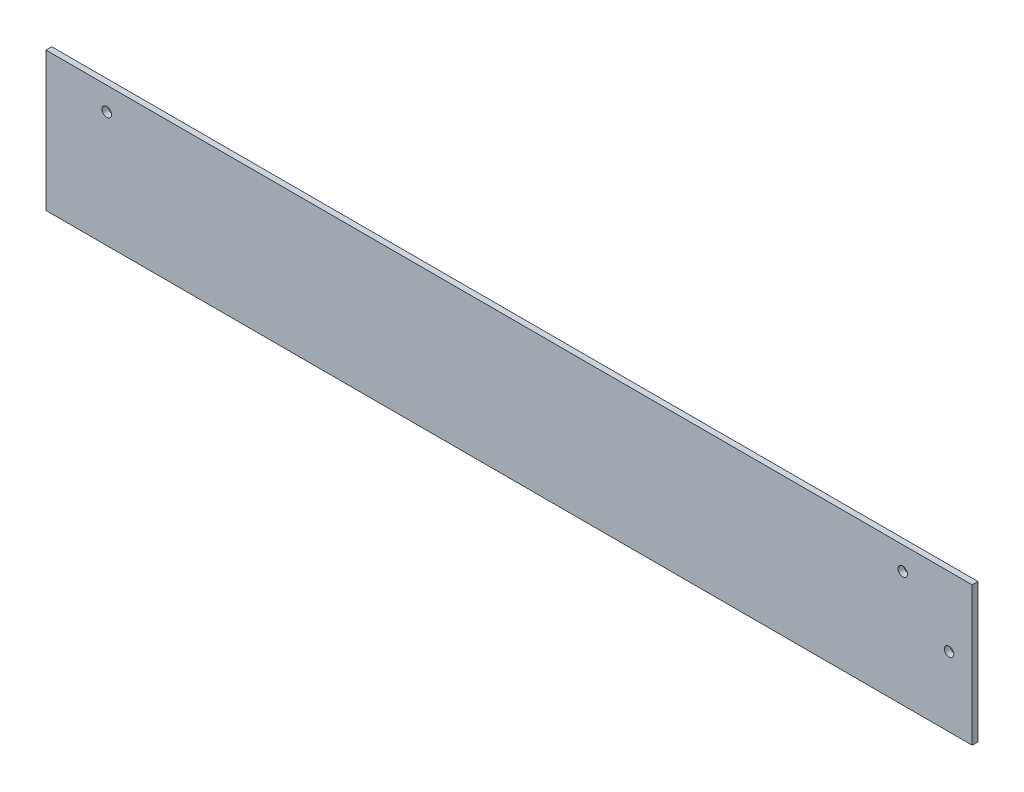
from build123d import *

# Parameters (mm, degrees)
SKETCH1_W           = 508
SKETCH1_H           = 508
BOSS_EXTRUDE1_DEPTH = 3.175
SKETCH2_R           = 2.54
SKETCH2_W           = 234.95
SKETCH2_H           = 368.3
CUT_EXTRUDE1_DEPTH  = 44.45
SKETCH4_R           = 2.159
CUT_EXTRUDE3_DEPTH  = 719.427505476
SKETCH5_R           = 2.6
CUT_EXTRUDE4_DEPTH  = 719.427505476
SKETCH6_W           = 20.6375
SKETCH6_H           = 119.54625
BOSS_EXTRUDE3_DEPTH = 3.175
SKETCH7_W           = 508
SKETCH7_H           = 431.8
CUT_EXTRUDE5_DEPTH  = 719.427505476


with BuildPart() as part:
    # Sketch1 → Boss-Extrude1 (new body)
    with BuildSketch(Plane.XY):
        with Locations((254, 254)):
            Rectangle(SKETCH1_W, SKETCH1_H)
    extrude(amount=BOSS_EXTRUDE1_DEPTH)

    # Sketch2 → Cut-Extrude1 (cut)
    with BuildSketch(Plane(origin=(0, 0, 0), x_dir=(-1, 0, 0), z_dir=(0, 0, -1))):
        with Locations((-339.725, 45.085)):
            Circle(SKETCH2_R)
        with Locations((-85.725, 45.085)):
            Circle(SKETCH2_R)
        with Locations((-339.725, 75.565)):
            Circle(SKETCH2_R)
        with Locations((-85.725, 75.565)):
            Circle(SKETCH2_R)
        with Locations((-212.725, 184.15)):
            Rectangle(SKETCH2_W, SKETCH2_H)
        Polygon((0, 403.06625), (0, 328.45375), (-20.6375, 328.45375), (-20.6375, 403.06625), (-20.6375, 508), (0, 508), align=None)
    extrude(amount=-CUT_EXTRUDE1_DEPTH, mode=Mode.SUBTRACT)

    # Sketch4 → Cut-Extrude3 (cut, through all)
    with BuildSketch(Plane(origin=(0, 0, 0), x_dir=(-1, 0, 0), z_dir=(0, 0, -1))):
        with Locations((-311.1754, 390.779)):
            Circle(SKETCH4_R)
        with Locations((-277.1394, 390.779)):
            Circle(SKETCH4_R)
        with Locations((-148.3614, 390.779)):
            Circle(SKETCH4_R)
        with Locations((-114.3254, 390.779)):
            Circle(SKETCH4_R)
    extrude(amount=-CUT_EXTRUDE3_DEPTH, mode=Mode.SUBTRACT)

    # Sketch5 → Cut-Extrude4 (cut, through all)
    with BuildSketch(Plane.XY.offset(3.175)):
        with Locations((12.7, 303.05375)):
            Circle(SKETCH5_R)
        with Locations((12.7, 177.8)):
            Circle(SKETCH5_R)
        with Locations((12.7, 38.1)):
            Circle(SKETCH5_R)
        with Locations((495.3, 38.1)):
            Circle(SKETCH5_R)
        with Locations((495.3, 177.8)):
            Circle(SKETCH5_R)
        with Locations((495.3, 303.05375)):
            Circle(SKETCH5_R)
        with Locations((495.3, 469.9)):
            Circle(SKETCH5_R)
        with Locations((57.15, 12.7)):
            Circle(SKETCH5_R)
        with Locations((368.3, 12.7)):
            Circle(SKETCH5_R)
        with Locations((444.5, 12.7)):
            Circle(SKETCH5_R)
        with Locations((33.3375, 495.3)):
            Circle(SKETCH5_R)
        with Locations((469.9, 495.3)):
            Circle(SKETCH5_R)
    extrude(amount=-CUT_EXTRUDE4_DEPTH, mode=Mode.SUBTRACT)

    # Sketch6 → Boss-Extrude3 (add)
    with BuildSketch(Plane.XY.offset(3.175)):
        with Locations((10.31875, 448.226875)):
            Rectangle(SKETCH6_W, SKETCH6_H)
    extrude(amount=-BOSS_EXTRUDE3_DEPTH)

    # Sketch7 → Cut-Extrude5 (cut, through all)
    with BuildSketch(Plane.XY.offset(3.175)):
        with Locations((254, 215.9)):
            Rectangle(SKETCH7_W, SKETCH7_H)
    extrude(amount=-CUT_EXTRUDE5_DEPTH, mode=Mode.SUBTRACT)


solid = part.part
